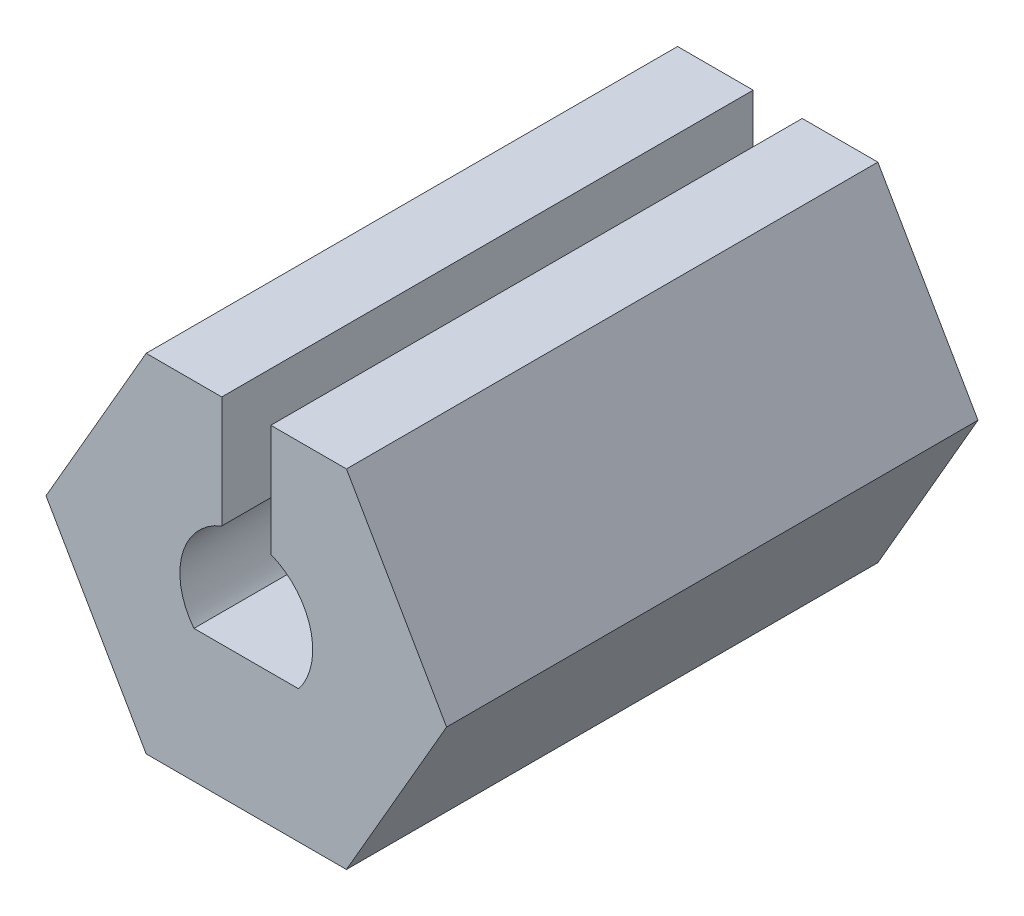
from build123d import *

# Parameters (mm, degrees)
BOSS_EXTRUDE1_DEPTH = 13


with BuildPart() as part:
    # Sketch1 → Boss-Extrude1 (new body)
    with BuildSketch(Plane.XY):
        with BuildLine():
            Line((1.280868846, -1), (-1.280868846, -1))
            ThreePointArc((-1.280868846, -1), (-1.568330344, 0.425399731), (-0.6, 1.510173831))
            Line((-0.6, 1.510173831), (-0.6, 4.243524479))
            Line((-0.6, 4.243524479), (-2.45, 4.243524479))
            Line((-2.45, 4.243524479), (-4.9, 0))
            Line((-4.9, 0), (-2.45, -4.243524479))
            Line((-2.45, -4.243524479), (2.45, -4.243524479))
            Line((2.45, -4.243524479), (4.9, 0))
            Line((4.9, 0), (2.45, 4.243524479))
            Line((2.45, 4.243524479), (0.6, 4.243524479))
            Line((0.6, 4.243524479), (0.6, 1.510173831))
            ThreePointArc((0.6, 1.510173831), (1.568330344, 0.425399731), (1.280868846, -1))
        make_face()
    extrude(amount=BOSS_EXTRUDE1_DEPTH)


solid = part.part
